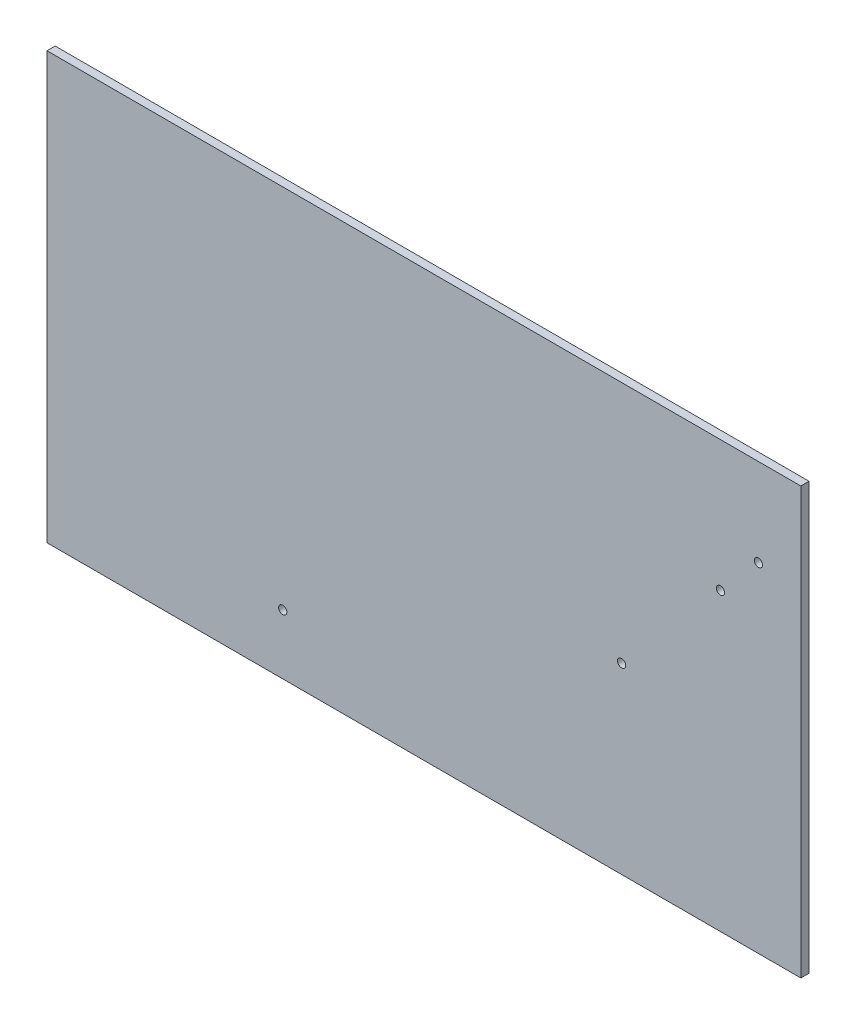
from build123d import *

# Parameters (mm, degrees)
SKETCH1_W           = 584.2
SKETCH1_H           = 330.2
SKETCH1_R           = 3.175
BOSS_EXTRUDE1_DEPTH = 6.35


with BuildPart() as part:
    # Sketch1 → Boss-Extrude1 (new body)
    with BuildSketch(Plane.XY):
        with Locations((292.1, 165.1)):
            Rectangle(SKETCH1_W, SKETCH1_H)
        with Locations((182.717550731, 46.277194957)):
            Circle(SKETCH1_R, mode=Mode.SUBTRACT)
        with Locations((445.267668978, 141.837623003)):
            Circle(SKETCH1_R, mode=Mode.SUBTRACT)
        with Locations((521.93327346, 228.950470164)):
            Circle(SKETCH1_R, mode=Mode.SUBTRACT)
        with Locations((551.299543138, 262.318489362)):
            Circle(SKETCH1_R, mode=Mode.SUBTRACT)
    extrude(amount=BOSS_EXTRUDE1_DEPTH)


solid = part.part
